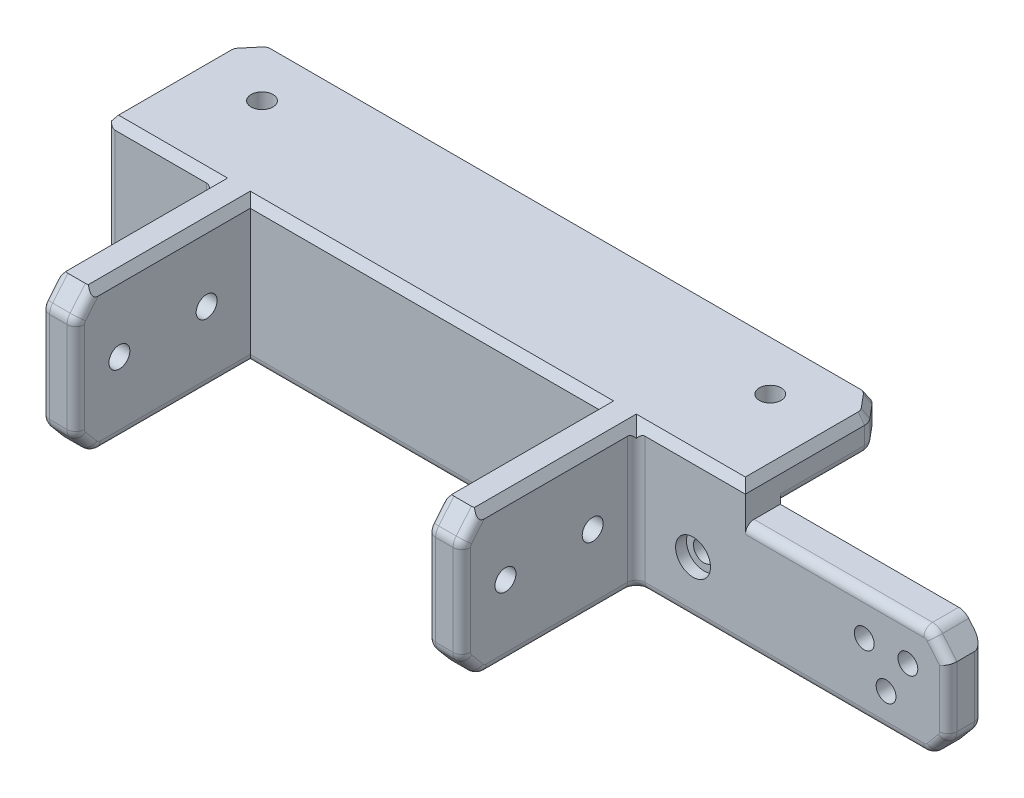
from build123d import *
from OCP.BRepFilletAPI import BRepFilletAPI_MakeChamfer

# Parameters (mm, degrees)
BOSS_EXTRUDE1_DEPTH = 12.5
SKETCH2_R           = 2.4
CUT_EXTRUDE1_DEPTH  = 127.871243787
SKETCH4_R           = 2.5
BOSS_EXTRUDE2_DEPTH = 8
SKETCH3_R           = 2.4
CUT_EXTRUDE2_DEPTH  = 176.921147109
SKETCH5_R           = 4
CUT_EXTRUDE3_DEPTH  = 2.5
CUT_EXTRUDE4_REACH  = 129.907
SKETCH8_R           = 2.275
CHAMFER1_SIZE       = 5
CHAMFER1_SIZE2      = 4.195498156
FILLET1_R           = 3
CHAMFER2_SIZE       = 2
CHAMFER2_SIZE2      = 1.400415076
FILLET2_R           = 2


with BuildPart() as part:
    # Sketch1 → Boss-Extrude1 (new, symmetric)
    with BuildSketch(Plane(origin=(0, 0, 0), x_dir=(1, 0, 0), z_dir=(0, 1, 0))):
        Polygon((119.75, 0), (119.75, -8), (48.25, -8), (48.25, -48), (40.25, -48), (40.25, -8), (-40.25, -8), (-40.25, -48), (-48.25, -48), (-48.25, -8), (-73.25, -8), (-73.25, 0), align=None)
    extrude(amount=BOSS_EXTRUDE1_DEPTH, both=True)

    # Sketch2 → Cut-Extrude1 (cut, through all)
    with BuildSketch(Plane.XY.offset(8)):
        with Locations((-61.25, 0)):
            Circle(SKETCH2_R)
        with Locations(Location((61.25, 0, 0), (0, 0, 180))):
            Circle(SKETCH2_R)
    extrude(amount=-CUT_EXTRUDE1_DEPTH, mode=Mode.SUBTRACT)

    # Sketch4 → Boss-Extrude2 (add)
    with BuildSketch(Plane(origin=(0, 12.5, 0), x_dir=(1, 0, 0), z_dir=(0, 1, 0))):
        Polygon((-73.25, -8), (-48.25, -8), (-48.25, -48), (-40.25, -48), (-40.25, -8), (40.25, -8), (40.25, -48), (48.25, -48), (48.25, -8), (73.25, -8), (73.25, 25.4), (-73.25, 25.4), align=None)
        with Locations(Location((-58.25, 12.7, 0), (0, 0, 270))):
            Circle(SKETCH4_R, mode=Mode.SUBTRACT)
        with Locations(Location((58.25, 12.7, 0), (0, 0, 270))):
            Circle(SKETCH4_R, mode=Mode.SUBTRACT)
    extrude(amount=BOSS_EXTRUDE2_DEPTH)

    # Sketch3 → Cut-Extrude2 (cut, through all)
    with BuildSketch(Plane.ZY.offset(48.25)):
        with Locations((18, 4)):
            Circle(SKETCH3_R)
        with Locations((38, 4)):
            Circle(SKETCH3_R)
    extrude(amount=-CUT_EXTRUDE2_DEPTH, mode=Mode.SUBTRACT)

    # Sketch5 → Cut-Extrude3 (cut)
    with BuildSketch(Plane.XY.offset(8)):
        with Locations((-61.25, 0)):
            Circle(SKETCH5_R)
        with Locations((61.25, 0)):
            Circle(SKETCH5_R)
    extrude(amount=-CUT_EXTRUDE3_DEPTH, mode=Mode.SUBTRACT)

    # Sketch8 → Cut-Extrude4 (cut, up to next)
    with BuildSketch(Plane.XY.offset(8), mode=Mode.PRIVATE) as cut_extrude4_sk1:
        with Locations((100.5, 3.5)):
            Circle(SKETCH8_R)
    cut_extrude4_tool1 = extrude(cut_extrude4_sk1.sketch, amount=-CUT_EXTRUDE4_REACH, mode=Mode.PRIVATE) & part.part
    # Sketch8 → Cut-Extrude4 (cut, up to next)
    with BuildSketch(Plane.XY.offset(8), mode=Mode.PRIVATE) as cut_extrude4_sk2:
        with Locations((110.5, 3.5)):
            Circle(SKETCH8_R)
    cut_extrude4_tool2 = extrude(cut_extrude4_sk2.sketch, amount=-CUT_EXTRUDE4_REACH, mode=Mode.PRIVATE) & part.part
    # Sketch8 → Cut-Extrude4 (cut, up to next)
    with BuildSketch(Plane.XY.offset(8), mode=Mode.PRIVATE) as cut_extrude4_sk3:
        with Locations((105.5, -4.5)):
            Circle(SKETCH8_R)
    cut_extrude4_tool3 = extrude(cut_extrude4_sk3.sketch, amount=-CUT_EXTRUDE4_REACH, mode=Mode.PRIVATE) & part.part
    add(cut_extrude4_tool1.solids().sort_by_distance((100.5, 3.5, 8))[0], mode=Mode.SUBTRACT)
    add(cut_extrude4_tool2.solids().sort_by_distance((110.5, 3.5, 8))[0], mode=Mode.SUBTRACT)
    add(cut_extrude4_tool3.solids().sort_by_distance((105.5, -4.5, 8))[0], mode=Mode.SUBTRACT)

    # Chamfer1: one chamfer whose edges measure the first distance from different faces: ONE call of the kernel's chamfer builder (chamfer() names one face for all edges)
    chamfer1_edges_1 = [part.edges().sort_by_distance(p)[0] for p in [
        (119.75, -12.5, 4),
        (119.75, 12.5, 4),
    ]]
    chamfer1_side_1 = [part.faces().sort_by_distance(p)[0] for p in [
        (119.75, 0, 4),
    ]]
    chamfer1_edges_2 = [part.edges().sort_by_distance(p)[0] for p in [
        (44.25, -12.5, 48),
        (44.25, 20.5, 48),
    ]]
    chamfer1_side_2 = [part.faces().sort_by_distance(p)[0] for p in [
        (44.25, 4, 48),
    ]]
    chamfer1_edges_3 = [part.edges().sort_by_distance(p)[0] for p in [
        (-44.25, -12.5, 48),
        (-44.25, 20.5, 48),
    ]]
    chamfer1_side_3 = [part.faces().sort_by_distance(p)[0] for p in [
        (-44.25, 4, 48),
    ]]
    chamfer1_edges_4 = [part.edges().sort_by_distance(p)[0] for p in [
        (-73.25, -12.5, 4),
        (-73.25, 16.5, -25.4),
    ]]
    chamfer1_side_4 = [part.faces().sort_by_distance(p)[0] for p in [
        (-73.25, 4, 7.530472578),
    ]]
    chamfer1_edges_5 = [part.edges().sort_by_distance(p)[0] for p in [
        (73.25, 16.5, -25.4),
    ]]
    chamfer1_side_5 = [part.faces().sort_by_distance(p)[0] for p in [
        (73.25, 16.5, -8.7),
    ]]
    chamfer1 = BRepFilletAPI_MakeChamfer(part.part.solid().wrapped)
    for e in chamfer1_edges_1:
        chamfer1.Add(CHAMFER1_SIZE, CHAMFER1_SIZE2, e.wrapped, chamfer1_side_1[0].wrapped)  # the first distance lies on this face
    for e in chamfer1_edges_2:
        chamfer1.Add(CHAMFER1_SIZE, CHAMFER1_SIZE2, e.wrapped, chamfer1_side_2[0].wrapped)  # the first distance lies on this face
    for e in chamfer1_edges_3:
        chamfer1.Add(CHAMFER1_SIZE, CHAMFER1_SIZE2, e.wrapped, chamfer1_side_3[0].wrapped)  # the first distance lies on this face
    for e in chamfer1_edges_4:
        chamfer1.Add(CHAMFER1_SIZE, CHAMFER1_SIZE2, e.wrapped, chamfer1_side_4[0].wrapped)  # the first distance lies on this face
    for e in chamfer1_edges_5:
        chamfer1.Add(CHAMFER1_SIZE, CHAMFER1_SIZE2, e.wrapped, chamfer1_side_5[0].wrapped)  # the first distance lies on this face
    add(Compound.cast(chamfer1.Shape()), mode=Mode.REPLACE)

    # Fillet1
    fillet1_edges = [part.edges().sort_by_distance(p)[0] for p in [
        (115.554501844, 12.5, 4),
        (119.75, -7.5, 4),
        (-69.054501844, 16.5, -25.4),
        (69.054501844, 16.5, -25.4),
        (73.25, 16.5, -20.4),
        (-73.25, -7.5, 4),
        (-73.25, 16.5, -20.4),
        (-44.25, -12.5, 43.804501844),
        (44.25, -12.5, 43.804501844),
        (-69.054501844, -12.5, 4),
        (115.554501844, -12.5, 4),
        (44.25, 15.5, 48),
        (44.25, -7.5, 48),
        (-44.25, 15.5, 48),
        (-44.25, -7.5, 48),
    ]]
    fillet(fillet1_edges, radius=FILLET1_R)

    # Chamfer2: one chamfer whose edges measure the first distance from different faces: ONE call of the kernel's chamfer builder (chamfer() names one face for all edges)
    chamfer2_edges_1 = [part.edges().sort_by_distance(p)[0] for p in [
        (-40.25, 20.5, 25.902250922),
    ]]
    chamfer2_side_1 = [part.faces().sort_by_distance(p)[0] for p in [
        (-40.25, 4.003479044, 27.683294078),
    ]]
    chamfer2_edges_2 = [part.edges().sort_by_distance(p)[0] for p in [
        (48.25, 20.5, 25.902250922),
    ]]
    chamfer2_side_2 = [part.faces().sort_by_distance(p)[0] for p in [
        (48.25, 4.003479044, 27.683294078),
    ]]
    chamfer2_edges_3 = [part.edges().sort_by_distance(p)[0] for p in [
        (0, 20.5, -25.4),
    ]]
    chamfer2_side_3 = [part.faces().sort_by_distance(p)[0] for p in [
        (0, 16.5, -25.4),
    ]]
    chamfer2_edges_4 = [part.edges().sort_by_distance(p)[0] for p in [
        (71.250922764, 20.5, -22.782407478),
    ]]
    chamfer2_side_4 = [part.faces().sort_by_distance(p)[0] for p in [
        (71.250922764, 16.5, -22.782407478),
    ]]
    chamfer2_edges_5 = [part.edges().sort_by_distance(p)[0] for p in [
        (-71.250922764, 20.5, -22.782407478),
    ]]
    chamfer2_side_5 = [part.faces().sort_by_distance(p)[0] for p in [
        (-71.250922764, 16.5, -22.782407478),
    ]]
    chamfer2_edges_6 = [part.edges().sort_by_distance(p)[0] for p in [
        (-73.25, 20.5, -5.654044649),
    ]]
    chamfer2_side_6 = [part.faces().sort_by_distance(p)[0] for p in [
        (-73.25, 7.045955351, 7.616623291),
    ]]
    chamfer2_edges_7 = [part.edges().sort_by_distance(p)[0] for p in [
        (73.069077862, 20.5, -20.334149727),
    ]]
    chamfer2_side_7 = [part.faces().sort_by_distance(p)[0] for p in [
        (73.069077862, 16.5, -20.334149727),
    ]]
    chamfer2_edges_8 = [part.edges().sort_by_distance(p)[0] for p in [
        (-68.923433655, 20.5, -25.118923361),
    ]]
    chamfer2_side_8 = [part.faces().sort_by_distance(p)[0] for p in [
        (-68.923433655, 16.5, -25.118923361),
    ]]
    chamfer2_edges_9 = [part.edges().sort_by_distance(p)[0] for p in [
        (-73.069077862, 20.5, -20.334149727),
    ]]
    chamfer2_side_9 = [part.faces().sort_by_distance(p)[0] for p in [
        (-73.069077862, 16.5, -20.334149727),
    ]]
    chamfer2_edges_10 = [part.edges().sort_by_distance(p)[0] for p in [
        (68.923433655, 20.5, -25.118923361),
    ]]
    chamfer2_side_10 = [part.faces().sort_by_distance(p)[0] for p in [
        (68.923433655, 16.5, -25.118923361),
    ]]
    chamfer2_edges_11 = [part.edges().sort_by_distance(p)[0] for p in [
        (-60.75, 20.5, 8),
    ]]
    chamfer2_side_11 = [part.faces().sort_by_distance(p)[0] for p in [
        (-60.559589419, 4.47466915, 8),
    ]]
    chamfer2_edges_12 = [part.edges().sort_by_distance(p)[0] for p in [
        (-48.25, 20.5, 25.902250922),
    ]]
    chamfer2_side_12 = [part.faces().sort_by_distance(p)[0] for p in [
        (-48.25, 4.003479044, 27.683294078),
    ]]
    chamfer2_edges_13 = [part.edges().sort_by_distance(p)[0] for p in [
        (0, 20.5, 8),
    ]]
    chamfer2_side_13 = [part.faces().sort_by_distance(p)[0] for p in [
        (0, 4, 8),
    ]]
    chamfer2_edges_14 = [part.edges().sort_by_distance(p)[0] for p in [
        (40.25, 20.5, 25.902250922),
    ]]
    chamfer2_side_14 = [part.faces().sort_by_distance(p)[0] for p in [
        (40.25, 4.003479044, 27.683294078),
    ]]
    chamfer2_edges_15 = [part.edges().sort_by_distance(p)[0] for p in [
        (60.75, 20.5, 8),
    ]]
    chamfer2_side_15 = [part.faces().sort_by_distance(p)[0] for p in [
        (81.162227583, 1.746487263, 8),
    ]]
    chamfer2_edges_16 = [part.edges().sort_by_distance(p)[0] for p in [
        (73.25, 20.5, -5.654044649),
    ]]
    chamfer2_side_16 = [part.faces().sort_by_distance(p)[0] for p in [
        (73.25, 16.5, -5.654044649),
    ]]
    chamfer2 = BRepFilletAPI_MakeChamfer(part.part.solid().wrapped)
    for e in chamfer2_edges_1:
        chamfer2.Add(CHAMFER2_SIZE, CHAMFER2_SIZE2, e.wrapped, chamfer2_side_1[0].wrapped)  # the first distance lies on this face
    for e in chamfer2_edges_2:
        chamfer2.Add(CHAMFER2_SIZE, CHAMFER2_SIZE2, e.wrapped, chamfer2_side_2[0].wrapped)  # the first distance lies on this face
    for e in chamfer2_edges_3:
        chamfer2.Add(CHAMFER2_SIZE, CHAMFER2_SIZE2, e.wrapped, chamfer2_side_3[0].wrapped)  # the first distance lies on this face
    for e in chamfer2_edges_4:
        chamfer2.Add(CHAMFER2_SIZE, CHAMFER2_SIZE2, e.wrapped, chamfer2_side_4[0].wrapped)  # the first distance lies on this face
    for e in chamfer2_edges_5:
        chamfer2.Add(CHAMFER2_SIZE, CHAMFER2_SIZE2, e.wrapped, chamfer2_side_5[0].wrapped)  # the first distance lies on this face
    for e in chamfer2_edges_6:
        chamfer2.Add(CHAMFER2_SIZE, CHAMFER2_SIZE2, e.wrapped, chamfer2_side_6[0].wrapped)  # the first distance lies on this face
    for e in chamfer2_edges_7:
        chamfer2.Add(CHAMFER2_SIZE, CHAMFER2_SIZE2, e.wrapped, chamfer2_side_7[0].wrapped)  # the first distance lies on this face
    for e in chamfer2_edges_8:
        chamfer2.Add(CHAMFER2_SIZE, CHAMFER2_SIZE2, e.wrapped, chamfer2_side_8[0].wrapped)  # the first distance lies on this face
    for e in chamfer2_edges_9:
        chamfer2.Add(CHAMFER2_SIZE, CHAMFER2_SIZE2, e.wrapped, chamfer2_side_9[0].wrapped)  # the first distance lies on this face
    for e in chamfer2_edges_10:
        chamfer2.Add(CHAMFER2_SIZE, CHAMFER2_SIZE2, e.wrapped, chamfer2_side_10[0].wrapped)  # the first distance lies on this face
    for e in chamfer2_edges_11:
        chamfer2.Add(CHAMFER2_SIZE, CHAMFER2_SIZE2, e.wrapped, chamfer2_side_11[0].wrapped)  # the first distance lies on this face
    for e in chamfer2_edges_12:
        chamfer2.Add(CHAMFER2_SIZE, CHAMFER2_SIZE2, e.wrapped, chamfer2_side_12[0].wrapped)  # the first distance lies on this face
    for e in chamfer2_edges_13:
        chamfer2.Add(CHAMFER2_SIZE, CHAMFER2_SIZE2, e.wrapped, chamfer2_side_13[0].wrapped)  # the first distance lies on this face
    for e in chamfer2_edges_14:
        chamfer2.Add(CHAMFER2_SIZE, CHAMFER2_SIZE2, e.wrapped, chamfer2_side_14[0].wrapped)  # the first distance lies on this face
    for e in chamfer2_edges_15:
        chamfer2.Add(CHAMFER2_SIZE, CHAMFER2_SIZE2, e.wrapped, chamfer2_side_15[0].wrapped)  # the first distance lies on this face
    for e in chamfer2_edges_16:
        chamfer2.Add(CHAMFER2_SIZE, CHAMFER2_SIZE2, e.wrapped, chamfer2_side_16[0].wrapped)  # the first distance lies on this face
    add(Compound.cast(chamfer2.Shape()), mode=Mode.REPLACE)

    # Fillet2
    fillet2_edges = [part.edges().sort_by_distance(p)[0] for p in [
        (-73.25, 6.045955351, 8),
        (-73.069077862, -7.434149727, 8),
        (-71.250922764, -9.882407478, 8),
        (-68.923433655, -12.218923361, 8),
        (-57.952789435, -12.5, 8),
        (119.569077862, -7.434149727, 8),
        (117.750922764, -9.882407478, 8),
        (115.423433655, -12.218923361, 8),
        (119.75, 0.545955351, 0),
        (119.569077862, -7.434149727, 0),
        (117.750922764, -9.882407478, 0),
        (115.423433655, -12.218923361, 0),
        (-73.25, 3.045955351, 0),
        (-73.069077862, -7.434149727, 0),
        (-71.250922764, -9.882407478, 0),
        (-68.923433655, -12.218923361, 0),
        (73.25, 12.5, -9.654044649),
        (71.250922764, 12.5, -22.782407478),
        (68.923433655, 12.5, -25.118923361),
        (0, 12.5, -25.4),
        (-68.923433655, 12.5, -25.118923361),
        (-71.250922764, 12.5, -22.782407478),
        (-73.069077862, 12.5, -20.334149727),
        (48.25, 17.418226063, 46.390417218),
        (48.25, 15.434149727, 47.819077862),
        (48.25, -12.5, 25.202789435),
        (48.25, -12.218923361, 43.673433655),
        (48.25, -9.882407478, 46.000922764),
        (48.25, -7.434149727, 47.819077862),
        (40.25, 17.418226063, 46.390417218),
        (40.25, 15.434149727, 47.819077862),
        (40.25, -12.5, 25.202789435),
        (40.25, -12.218923361, 43.673433655),
        (40.25, -9.882407478, 46.000922764),
        (40.25, -7.434149727, 47.819077862),
        (-40.25, 17.418226063, 46.390417218),
        (-40.25, 15.434149727, 47.819077862),
        (-40.25, -12.5, 25.202789435),
        (-40.25, -12.218923361, 43.673433655),
        (-40.25, -9.882407478, 46.000922764),
        (-40.25, -7.434149727, 47.819077862),
        (-48.25, -12.5, 25.202789435),
        (-48.25, -12.218923361, 43.673433655),
        (-48.25, -9.882407478, 46.000922764),
        (-48.25, -7.434149727, 47.819077862),
        (-48.25, 4, 48),
        (-48.25, 15.434149727, 47.819077862),
        (48.25, 3, 8),
        (81.202789435, -12.5, 8),
        (0, -12.5, 8),
        (23.25, -12.5, 0),
        (-73.25, 12.5, -9.654044649),
        (-48.25, 3, 8),
        (48.25, 4, 48),
        (40.25, 4, 48),
        (-40.25, 4, 48),
        (-48.25, 17.418226063, 46.390417218),
        (119.75, 0.545955351, 8),
        (73.069077862, 12.5, -20.334149727),
        (118.1018561, 9.464181415, 8),
        (115.423433655, 12.218923361, 8),
        (93.702789435, 12.5, 8),
    ]]
    fillet(fillet2_edges, radius=FILLET2_R)


solid = part.part
